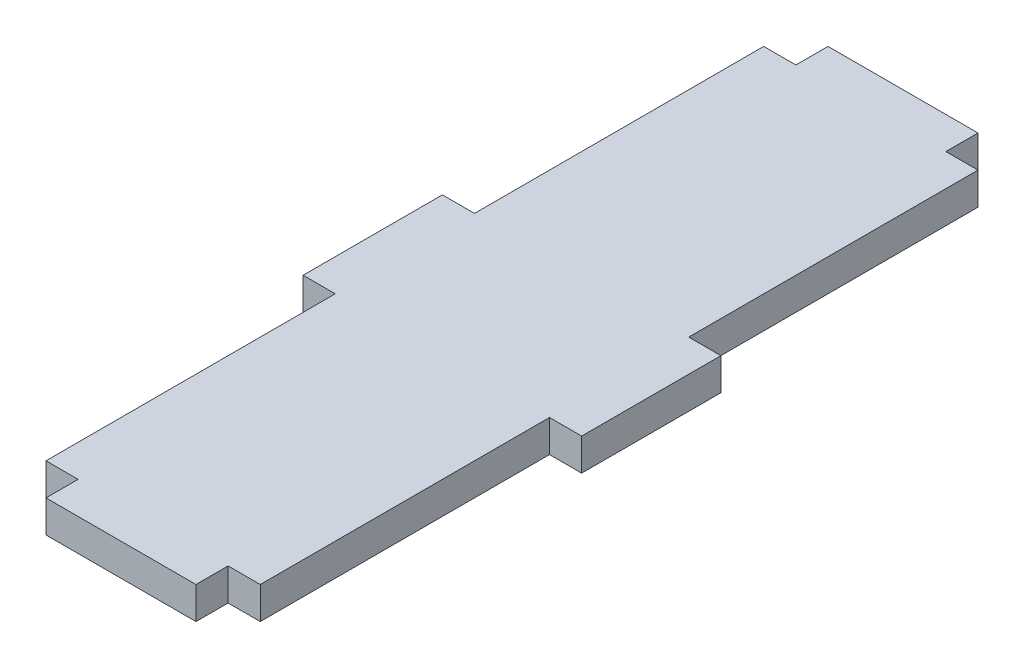
from build123d import *

# Parameters (mm, degrees)
SALIENTE_EXTRUIR1_DEPTH = 3


with BuildPart() as part:
    # Croquis2 → Saliente-Extruir1 (new body)
    with BuildSketch(Plane(origin=(0, 0, 0), x_dir=(1, 0, 0), z_dir=(0, 1, 0))):
        Polygon((-4.5, 22), (-4.5, 9), (-1.5, 9), (-1.5, -18), (1.5, -18), (1.5, -21), (15.5, -21), (15.5, -18), (18.5, -18), (18.5, 9), (21.5, 9), (21.5, 22), (18.5, 22), (18.5, 49), (15.5, 49), (15.5, 52), (1.5, 52), (1.5, 49), (-1.5, 49), (-1.5, 22), align=None)
    extrude(amount=SALIENTE_EXTRUIR1_DEPTH)


solid = part.part
